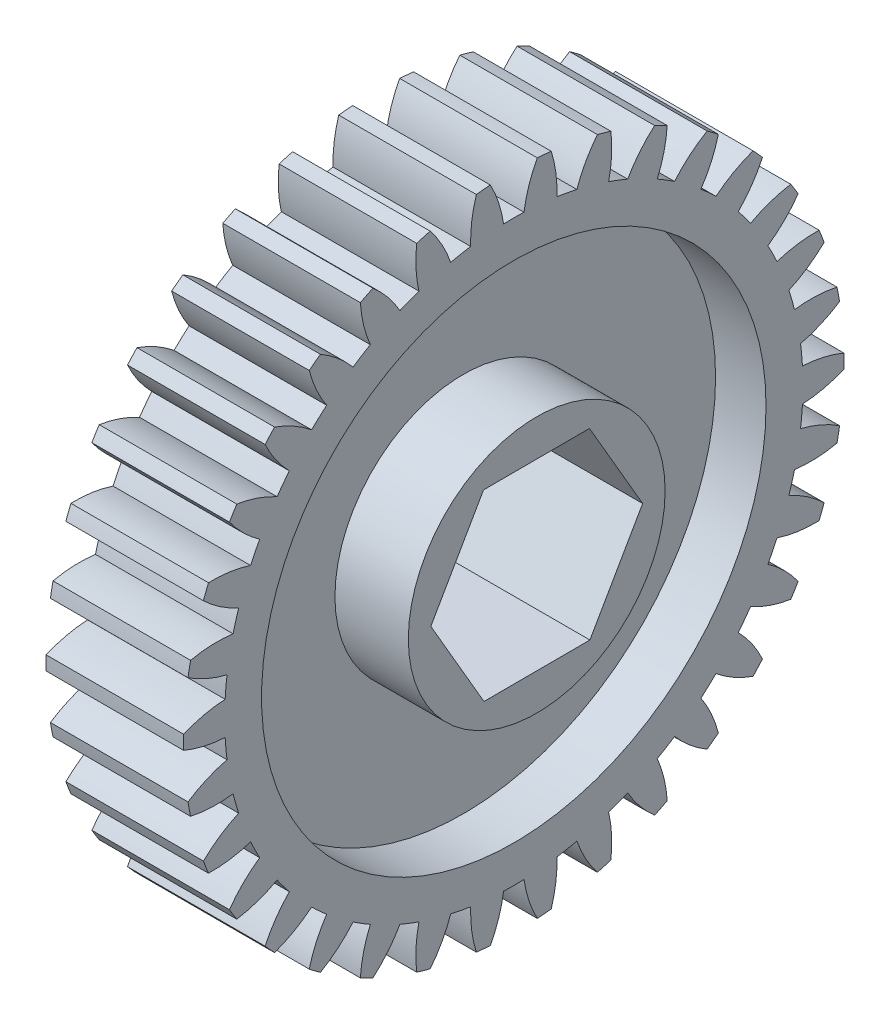
from build123d import *

# Parameters (mm, degrees)
SKETCH1_W           = 9.525
SKETCH1_H           = 22.86
CUT_EXTRUDE1_DEPTH  = 34.702890455
CUT_EXTRUDE2_DEPTH  = 34.702890455
CUT_EXTRUDE3_DEPTH  = 34.702890455
CUT_EXTRUDE4_DEPTH  = 34.702890455
CUT_EXTRUDE5_DEPTH  = 34.702890455
CUT_EXTRUDE6_DEPTH  = 34.702890455
CUT_EXTRUDE7_DEPTH  = 34.702890455
CUT_EXTRUDE8_DEPTH  = 34.702890455
CUT_EXTRUDE9_DEPTH  = 34.702890455
CUT_EXTRUDE10_DEPTH = 34.702890455
CUT_EXTRUDE11_DEPTH = 34.702890455
CUT_EXTRUDE12_DEPTH = 34.702890455
CUT_EXTRUDE13_DEPTH = 34.702890455
CUT_EXTRUDE14_DEPTH = 34.702890455
CUT_EXTRUDE15_DEPTH = 34.702890455
CUT_EXTRUDE16_DEPTH = 34.702890455
CUT_EXTRUDE17_DEPTH = 34.702890455
CUT_EXTRUDE18_DEPTH = 34.702890455
CUT_EXTRUDE19_DEPTH = 34.702890455
CUT_EXTRUDE20_DEPTH = 34.663653627
CUT_EXTRUDE21_DEPTH = 34.663653627
CUT_EXTRUDE22_DEPTH = 34.663653627
CUT_EXTRUDE23_DEPTH = 34.663653627
CUT_EXTRUDE24_DEPTH = 34.663653627
CUT_EXTRUDE25_DEPTH = 34.663653627
CUT_EXTRUDE26_DEPTH = 34.663653627
CUT_EXTRUDE27_DEPTH = 34.663653627
CUT_EXTRUDE28_DEPTH = 34.663653627
CUT_EXTRUDE29_DEPTH = 34.663653627
CUT_EXTRUDE30_DEPTH = 34.663653627
CUT_EXTRUDE31_DEPTH = 34.663653627
CUT_EXTRUDE32_DEPTH = 34.663653627
CUT_EXTRUDE33_DEPTH = 34.663653627
CUT_EXTRUDE34_DEPTH = 34.663653627
HOLE1_D             = 34.925
HOLE1_DEPTH         = 3.4925
SKETCH38_R          = 8.89
BOSS_EXTRUDE1_DEPTH = 5.08
HOLE2_D             = 34.925
HOLE2_DEPTH         = 3.4925
BOSS_EXTRUDE2_START = 5.08
SKETCH41_R          = 8.89
BOSS_EXTRUDE2_DEPTH = 5.08
CUT_EXTRUDE35_DEPTH = 35.695906826


with BuildPart() as part:
    # Sketch1 → Revolve1 (revolve)
    with BuildSketch(Plane(origin=(0, 0, 0), x_dir=(-1, 0, 0), z_dir=(0, 0, -1)), mode=Mode.PRIVATE) as revolve1_sk:
        with Locations((-4.7625, 11.43)):
            Rectangle(SKETCH1_W, SKETCH1_H)
    revolve(revolve1_sk.sketch.rotate(Axis((9.525, 0, 0), (-1, 0, 0)), 270), axis=Axis((9.525, 0, 0), (-1, 0, 0)))

    # Sketch2 → Cut-Extrude1 (cut, through all)
    with BuildSketch(Plane.ZY):
        with BuildLine():
            ThreePointArc((-2.59175236, 22.712604864), (-4.200513977, 22.470765059), (-5.788002123, 22.115122234))
            ThreePointArc((-5.788002123, 22.115122234), (-4.967471803, 20.884821102), (-4.368873641, 19.532567014))
            ThreePointArc((-4.368873641, 19.532567014), (-3.677783349, 19.674403185), (-2.982123709, 19.791795503))
            ThreePointArc((-2.982123709, 19.791795503), (-2.912438066, 21.268973485), (-2.59175236, 22.712604864))
        make_face()
    extrude(amount=-CUT_EXTRUDE1_DEPTH, mode=Mode.SUBTRACT)

    # Sketch3 → Cut-Extrude2 (cut, through all)
    with BuildSketch(Plane.ZY):
        with BuildLine():
            ThreePointArc((1.625807341, 22.802112851), (0, 22.86), (-1.625807341, 22.802112851))
            ThreePointArc((-1.625807341, 22.802112851), (-1.045315349, 21.441987884), (-0.705385495, 20.002766367))
            ThreePointArc((-0.705385495, 20.002766367), (0, 20.0152), (0.705385495, 20.002766367))
            ThreePointArc((0.705385495, 20.002766367), (1.045315349, 21.441987884), (1.625807341, 22.802112851))
        make_face()
    extrude(amount=-CUT_EXTRUDE2_DEPTH, mode=Mode.SUBTRACT)

    # Sketch4 → Cut-Extrude3 (cut, through all)
    with BuildSketch(Plane.ZY):
        with BuildLine():
            ThreePointArc((5.788002123, 22.115122234), (4.200513977, 22.470765059), (2.59175236, 22.712604864))
            ThreePointArc((2.59175236, 22.712604864), (2.912438066, 21.268973485), (2.982123709, 19.791795503))
            ThreePointArc((2.982123709, 19.791795503), (3.677783349, 19.674403185), (4.368873641, 19.532567014))
            ThreePointArc((4.368873641, 19.532567014), (4.967471803, 20.884821102), (5.788002123, 22.115122234))
        make_face()
    extrude(amount=-CUT_EXTRUDE3_DEPTH, mode=Mode.SUBTRACT)

    # Sketch5 → Cut-Extrude4 (cut, through all)
    with BuildSketch(Plane.ZY):
        with BuildLine():
            ThreePointArc((9.753093435, 20.675027653), (8.257984489, 21.316315164), (6.721053043, 21.849646359))
            ThreePointArc((6.721053043, 21.849646359), (6.771011896, 20.371669703), (6.568080266, 18.90683878))
            ThreePointArc((6.568080266, 18.90683878), (7.230324197, 18.663618166), (7.883585036, 18.397209517))
            ThreePointArc((7.883585036, 18.397209517), (8.720466963, 19.616446787), (9.753093435, 20.675027653))
        make_face()
    extrude(amount=-CUT_EXTRUDE4_DEPTH, mode=Mode.SUBTRACT)

    # Sketch6 → Cut-Extrude5 (cut, through all)
    with BuildSketch(Plane.ZY):
        with BuildLine():
            ThreePointArc((13.386054847, 18.530869802), (12.034239243, 19.435963723), (10.621476326, 20.242624352))
            ThreePointArc((10.621476326, 20.242624352), (10.399007036, 18.780633143), (9.930368727, 17.378032339))
            ThreePointArc((9.930368727, 17.378032339), (10.536645026, 17.017266015), (11.129830397, 16.635357116))
            ThreePointArc((11.129830397, 16.635357116), (12.17649708, 17.680057903), (13.386054847, 18.530869802))
        make_face()
    extrude(amount=-CUT_EXTRUDE5_DEPTH, mode=Mode.SUBTRACT)

    # Sketch7 → Cut-Extrude6 (cut, through all)
    with BuildSketch(Plane.ZY):
        with BuildLine():
            ThreePointArc((16.563170217, 15.755665406), (15.400682414, 16.893743848), (14.160197971, 17.946264052))
            ThreePointArc((14.160197971, 17.946264052), (13.672876465, 16.550044646), (12.954490392, 15.257437849))
            ThreePointArc((12.954490392, 15.257437849), (13.484153047, 14.79141128), (13.997062733, 14.30700758))
            ThreePointArc((13.997062733, 14.30700758), (15.217871193, 15.141595853), (16.563170217, 15.755665406))
        make_face()
    extrude(amount=-CUT_EXTRUDE6_DEPTH, mode=Mode.SUBTRACT)

    # Sketch8 → Cut-Extrude7 (cut, through all)
    with BuildSketch(Plane.ZY):
        with BuildLine():
            ThreePointArc((19.17624669, 12.44392072), (18.242673816, 13.776227788), (17.216711058, 15.038765253))
            ThreePointArc((17.216711058, 15.038765253), (16.481132483, 13.755864228), (15.537462423, 12.617269613))
            ThreePointArc((15.537462423, 12.617269613), (15.972474407, 12.061852774), (16.387641885, 11.49145006))
            ThreePointArc((16.387641885, 11.49145006), (17.741018954, 12.087504915), (19.17624669, 12.44392072))
        make_face()
    extrude(amount=-CUT_EXTRUDE7_DEPTH, mode=Mode.SUBTRACT)

    # Sketch9 → Cut-Extrude8 (cut, through all)
    with BuildSketch(Plane.ZY):
        with BuildLine():
            ThreePointArc((21.136299081, 8.70841324), (20.46343284, 10.189578813), (19.686929699, 11.619139341))
            ThreePointArc((19.686929699, 11.619139341), (18.728143303, 10.493244352), (17.591324807, 9.547435393))
            ThreePointArc((17.591324807, 9.547435393), (17.916872309, 8.921542339), (18.220159548, 8.284564991))
            ThreePointArc((18.220159548, 8.284564991), (19.660017592, 8.621788496), (21.136299081, 8.70841324))
        make_face()
    extrude(amount=-CUT_EXTRUDE8_DEPTH, mode=Mode.SUBTRACT)

    # Sketch10 → Cut-Extrude9 (cut, through all)
    with BuildSketch(Plane.ZY):
        with BuildLine():
            ThreePointArc((22.376580157, 4.676351191), (21.987334203, 6.255935953), (21.486733561, 7.803837574))
            ThreePointArc((21.486733561, 7.803837574), (20.337389664, 6.873289625), (19.046135723, 6.152474711))
            ThreePointArc((19.046135723, 6.152474711), (19.251132613, 5.477419479), (19.43221153, 4.795558997))
            ThreePointArc((19.43221153, 4.795558997), (20.909517911, 4.86246741), (22.376580157, 4.676351191))
        make_face()
    extrude(amount=-CUT_EXTRUDE9_DEPTH, mode=Mode.SUBTRACT)

    # Sketch11 → Cut-Extrude10 (cut, through all)
    with BuildSketch(Plane.ZY):
        with BuildLine():
            ThreePointArc((22.854853634, 0.485041611), (22.76248327, 2.109254697), (22.554832482, 3.722785479))
            ThreePointArc((22.554832482, 3.722785479), (21.254070611, 3.019273263), (19.85235333, 2.547998882))
            ThreePointArc((19.85235333, 2.547998882), (19.929818685, 1.846769668), (19.982522855, 1.143245993))
            ThreePointArc((19.982522855, 1.143245993), (21.446969676, 0.937560828), (22.854853634, 0.485041611))
        make_face()
    extrude(amount=-CUT_EXTRUDE10_DEPTH, mode=Mode.SUBTRACT)

    # Sketch12 → Cut-Extrude11 (cut, through all)
    with BuildSketch(Plane.ZY):
        with BuildLine():
            ThreePointArc((22.554832482, -3.722785479), (22.76248327, -2.109254697), (22.854853634, -0.485041611))
            ThreePointArc((22.854853634, -0.485041611), (21.446969676, -0.937560828), (19.982522855, -1.143245993))
            ThreePointArc((19.982522855, -1.143245993), (19.929818685, -1.846769668), (19.85235333, -2.547998882))
            ThreePointArc((19.85235333, -2.547998882), (21.254070611, -3.019273263), (22.554832482, -3.722785479))
        make_face()
    extrude(amount=-CUT_EXTRUDE11_DEPTH, mode=Mode.SUBTRACT)

    # Sketch13 → Cut-Extrude12 (cut, through all)
    with BuildSketch(Plane.ZY):
        with BuildLine():
            ThreePointArc((21.486733561, -7.803837574), (21.987334203, -6.255935953), (22.376580157, -4.676351191))
            ThreePointArc((22.376580157, -4.676351191), (20.909517911, -4.86246741), (19.43221153, -4.795558997))
            ThreePointArc((19.43221153, -4.795558997), (19.251132613, -5.477419479), (19.046135723, -6.152474711))
            ThreePointArc((19.046135723, -6.152474711), (20.337389664, -6.873289625), (21.486733561, -7.803837574))
        make_face()
    extrude(amount=-CUT_EXTRUDE12_DEPTH, mode=Mode.SUBTRACT)

    # Sketch14 → Cut-Extrude13 (cut, through all)
    with BuildSketch(Plane.ZY):
        with BuildLine():
            ThreePointArc((19.686929699, -11.619139341), (20.46343284, -10.189578813), (21.136299081, -8.70841324))
            ThreePointArc((21.136299081, -8.70841324), (19.660017592, -8.621788496), (18.220159548, -8.284564991))
            ThreePointArc((18.220159548, -8.284564991), (17.916872309, -8.921542339), (17.591324807, -9.547435393))
            ThreePointArc((17.591324807, -9.547435393), (18.728143303, -10.493244352), (19.686929699, -11.619139341))
        make_face()
    extrude(amount=-CUT_EXTRUDE13_DEPTH, mode=Mode.SUBTRACT)

    # Sketch15 → Cut-Extrude14 (cut, through all)
    with BuildSketch(Plane.ZY):
        with BuildLine():
            ThreePointArc((17.216711058, -15.038765253), (18.242673816, -13.776227788), (19.17624669, -12.44392072))
            ThreePointArc((19.17624669, -12.44392072), (17.741018954, -12.087504915), (16.387641885, -11.49145006))
            ThreePointArc((16.387641885, -11.49145006), (15.972474407, -12.061852774), (15.537462423, -12.617269613))
            ThreePointArc((15.537462423, -12.617269613), (16.481132483, -13.755864228), (17.216711058, -15.038765253))
        make_face()
    extrude(amount=-CUT_EXTRUDE14_DEPTH, mode=Mode.SUBTRACT)

    # Sketch16 → Cut-Extrude15 (cut, through all)
    with BuildSketch(Plane.ZY):
        with BuildLine():
            ThreePointArc((14.160197971, -17.946264052), (15.400682414, -16.893743848), (16.563170217, -15.755665406))
            ThreePointArc((16.563170217, -15.755665406), (15.217871193, -15.141595853), (13.997062733, -14.30700758))
            ThreePointArc((13.997062733, -14.30700758), (13.484153047, -14.79141128), (12.954490392, -15.257437849))
            ThreePointArc((12.954490392, -15.257437849), (13.672876465, -16.550044646), (14.160197971, -17.946264052))
        make_face()
    extrude(amount=-CUT_EXTRUDE15_DEPTH, mode=Mode.SUBTRACT)

    # Sketch17 → Cut-Extrude16 (cut, through all)
    with BuildSketch(Plane.ZY):
        with BuildLine():
            ThreePointArc((10.621476326, -20.242624352), (12.034239243, -19.435963723), (13.386054847, -18.530869802))
            ThreePointArc((13.386054847, -18.530869802), (12.17649708, -17.680057903), (11.129830397, -16.635357116))
            ThreePointArc((11.129830397, -16.635357116), (10.536645026, -17.017266015), (9.930368727, -17.378032339))
            ThreePointArc((9.930368727, -17.378032339), (10.399007036, -18.780633143), (10.621476326, -20.242624352))
        make_face()
    extrude(amount=-CUT_EXTRUDE16_DEPTH, mode=Mode.SUBTRACT)

    # Sketch18 → Cut-Extrude17 (cut, through all)
    with BuildSketch(Plane.ZY):
        with BuildLine():
            ThreePointArc((6.721053043, -21.849646359), (8.257984489, -21.316315164), (9.753093435, -20.675027653))
            ThreePointArc((9.753093435, -20.675027653), (8.720466963, -19.616446787), (7.883585036, -18.397209517))
            ThreePointArc((7.883585036, -18.397209517), (7.230324197, -18.663618166), (6.568080266, -18.90683878))
            ThreePointArc((6.568080266, -18.90683878), (6.771011896, -20.371669703), (6.721053043, -21.849646359))
        make_face()
    extrude(amount=-CUT_EXTRUDE17_DEPTH, mode=Mode.SUBTRACT)

    # Sketch19 → Cut-Extrude18 (cut, through all)
    with BuildSketch(Plane.ZY):
        with BuildLine():
            ThreePointArc((2.59175236, -22.712604864), (4.200513977, -22.470765059), (5.788002123, -22.115122234))
            ThreePointArc((5.788002123, -22.115122234), (4.967471803, -20.884821102), (4.368873641, -19.532567014))
            ThreePointArc((4.368873641, -19.532567014), (3.677783349, -19.674403185), (2.982123709, -19.791795503))
            ThreePointArc((2.982123709, -19.791795503), (2.912438066, -21.268973485), (2.59175236, -22.712604864))
        make_face()
    extrude(amount=-CUT_EXTRUDE18_DEPTH, mode=Mode.SUBTRACT)

    # Sketch20 → Cut-Extrude19 (cut, through all)
    with BuildSketch(Plane.ZY):
        with BuildLine():
            ThreePointArc((-1.625807341, -22.802112851), (0, -22.86), (1.625807341, -22.802112851))
            ThreePointArc((1.625807341, -22.802112851), (1.045315349, -21.441987884), (0.705385495, -20.002766367))
            ThreePointArc((0.705385495, -20.002766367), (0, -20.0152), (-0.705385495, -20.002766367))
            ThreePointArc((-0.705385495, -20.002766367), (-1.045315349, -21.441987884), (-1.625807341, -22.802112851))
        make_face()
    extrude(amount=-CUT_EXTRUDE19_DEPTH, mode=Mode.SUBTRACT)

    # Sketch21 → Cut-Extrude20 (cut, through all)
    with BuildSketch(Plane.ZY):
        with BuildLine():
            ThreePointArc((-5.788002123, -22.115122234), (-4.200513977, -22.470765059), (-2.59175236, -22.712604864))
            ThreePointArc((-2.59175236, -22.712604864), (-2.912438066, -21.268973485), (-2.982123709, -19.791795503))
            ThreePointArc((-2.982123709, -19.791795503), (-3.677783349, -19.674403185), (-4.368873641, -19.532567014))
            ThreePointArc((-4.368873641, -19.532567014), (-4.967471803, -20.884821102), (-5.788002123, -22.115122234))
        make_face()
    extrude(amount=-CUT_EXTRUDE20_DEPTH, mode=Mode.SUBTRACT)

    # Sketch22 → Cut-Extrude21 (cut, through all)
    with BuildSketch(Plane.ZY):
        with BuildLine():
            ThreePointArc((-9.753093435, -20.675027653), (-8.257984489, -21.316315164), (-6.721053043, -21.849646359))
            ThreePointArc((-6.721053043, -21.849646359), (-6.771011896, -20.371669703), (-6.568080266, -18.90683878))
            ThreePointArc((-6.568080266, -18.90683878), (-7.230324197, -18.663618166), (-7.883585036, -18.397209517))
            ThreePointArc((-7.883585036, -18.397209517), (-8.720466963, -19.616446787), (-9.753093435, -20.675027653))
        make_face()
    extrude(amount=-CUT_EXTRUDE21_DEPTH, mode=Mode.SUBTRACT)

    # Sketch23 → Cut-Extrude22 (cut, through all)
    with BuildSketch(Plane.ZY):
        with BuildLine():
            ThreePointArc((-13.386054847, -18.530869802), (-12.034239243, -19.435963723), (-10.621476326, -20.242624352))
            ThreePointArc((-10.621476326, -20.242624352), (-10.399007036, -18.780633143), (-9.930368727, -17.378032339))
            ThreePointArc((-9.930368727, -17.378032339), (-10.536645026, -17.017266015), (-11.129830397, -16.635357116))
            ThreePointArc((-11.129830397, -16.635357116), (-12.17649708, -17.680057903), (-13.386054847, -18.530869802))
        make_face()
    extrude(amount=-CUT_EXTRUDE22_DEPTH, mode=Mode.SUBTRACT)

    # Sketch24 → Cut-Extrude23 (cut, through all)
    with BuildSketch(Plane.ZY):
        with BuildLine():
            ThreePointArc((-16.563170217, -15.755665406), (-15.400682414, -16.893743848), (-14.160197971, -17.946264052))
            ThreePointArc((-14.160197971, -17.946264052), (-13.672876465, -16.550044646), (-12.954490392, -15.257437849))
            ThreePointArc((-12.954490392, -15.257437849), (-13.484153047, -14.79141128), (-13.997062733, -14.30700758))
            ThreePointArc((-13.997062733, -14.30700758), (-15.217871193, -15.141595853), (-16.563170217, -15.755665406))
        make_face()
    extrude(amount=-CUT_EXTRUDE23_DEPTH, mode=Mode.SUBTRACT)

    # Sketch25 → Cut-Extrude24 (cut, through all)
    with BuildSketch(Plane.ZY):
        with BuildLine():
            ThreePointArc((-19.17624669, -12.44392072), (-18.242673816, -13.776227788), (-17.216711058, -15.038765253))
            ThreePointArc((-17.216711058, -15.038765253), (-16.481132483, -13.755864228), (-15.537462423, -12.617269613))
            ThreePointArc((-15.537462423, -12.617269613), (-15.972474407, -12.061852774), (-16.387641885, -11.49145006))
            ThreePointArc((-16.387641885, -11.49145006), (-17.741018954, -12.087504915), (-19.17624669, -12.44392072))
        make_face()
    extrude(amount=-CUT_EXTRUDE24_DEPTH, mode=Mode.SUBTRACT)

    # Sketch26 → Cut-Extrude25 (cut, through all)
    with BuildSketch(Plane.ZY):
        with BuildLine():
            ThreePointArc((-21.136299081, -8.70841324), (-20.46343284, -10.189578813), (-19.686929699, -11.619139341))
            ThreePointArc((-19.686929699, -11.619139341), (-18.728143303, -10.493244352), (-17.591324807, -9.547435393))
            ThreePointArc((-17.591324807, -9.547435393), (-17.916872309, -8.921542339), (-18.220159548, -8.284564991))
            ThreePointArc((-18.220159548, -8.284564991), (-19.660017592, -8.621788496), (-21.136299081, -8.70841324))
        make_face()
    extrude(amount=-CUT_EXTRUDE25_DEPTH, mode=Mode.SUBTRACT)

    # Sketch27 → Cut-Extrude26 (cut, through all)
    with BuildSketch(Plane.ZY):
        with BuildLine():
            ThreePointArc((-22.376580157, -4.676351191), (-21.987334203, -6.255935953), (-21.486733561, -7.803837574))
            ThreePointArc((-21.486733561, -7.803837574), (-20.337389664, -6.873289625), (-19.046135723, -6.152474711))
            ThreePointArc((-19.046135723, -6.152474711), (-19.251132613, -5.477419479), (-19.43221153, -4.795558997))
            ThreePointArc((-19.43221153, -4.795558997), (-20.909517911, -4.86246741), (-22.376580157, -4.676351191))
        make_face()
    extrude(amount=-CUT_EXTRUDE26_DEPTH, mode=Mode.SUBTRACT)

    # Sketch28 → Cut-Extrude27 (cut, through all)
    with BuildSketch(Plane.ZY):
        with BuildLine():
            ThreePointArc((-22.854853634, -0.485041611), (-22.76248327, -2.109254697), (-22.554832482, -3.722785479))
            ThreePointArc((-22.554832482, -3.722785479), (-21.254070611, -3.019273263), (-19.85235333, -2.547998882))
            ThreePointArc((-19.85235333, -2.547998882), (-19.929818685, -1.846769668), (-19.982522855, -1.143245993))
            ThreePointArc((-19.982522855, -1.143245993), (-21.446969676, -0.937560828), (-22.854853634, -0.485041611))
        make_face()
    extrude(amount=-CUT_EXTRUDE27_DEPTH, mode=Mode.SUBTRACT)

    # Sketch29 → Cut-Extrude28 (cut, through all)
    with BuildSketch(Plane.ZY):
        with BuildLine():
            ThreePointArc((-22.554832482, 3.722785479), (-22.76248327, 2.109254697), (-22.854853634, 0.485041611))
            ThreePointArc((-22.854853634, 0.485041611), (-21.446969676, 0.937560828), (-19.982522855, 1.143245993))
            ThreePointArc((-19.982522855, 1.143245993), (-19.929818685, 1.846769668), (-19.85235333, 2.547998882))
            ThreePointArc((-19.85235333, 2.547998882), (-21.254070611, 3.019273263), (-22.554832482, 3.722785479))
        make_face()
    extrude(amount=-CUT_EXTRUDE28_DEPTH, mode=Mode.SUBTRACT)

    # Sketch30 → Cut-Extrude29 (cut, through all)
    with BuildSketch(Plane.ZY):
        with BuildLine():
            ThreePointArc((-21.486733561, 7.803837574), (-21.987334203, 6.255935953), (-22.376580157, 4.676351191))
            ThreePointArc((-22.376580157, 4.676351191), (-20.909517911, 4.86246741), (-19.43221153, 4.795558997))
            ThreePointArc((-19.43221153, 4.795558997), (-19.251132613, 5.477419479), (-19.046135723, 6.152474711))
            ThreePointArc((-19.046135723, 6.152474711), (-20.337389664, 6.873289625), (-21.486733561, 7.803837574))
        make_face()
    extrude(amount=-CUT_EXTRUDE29_DEPTH, mode=Mode.SUBTRACT)

    # Sketch31 → Cut-Extrude30 (cut, through all)
    with BuildSketch(Plane.ZY):
        with BuildLine():
            ThreePointArc((-19.686929699, 11.619139341), (-20.46343284, 10.189578813), (-21.136299081, 8.70841324))
            ThreePointArc((-21.136299081, 8.70841324), (-19.660017592, 8.621788496), (-18.220159548, 8.284564991))
            ThreePointArc((-18.220159548, 8.284564991), (-17.916872309, 8.921542339), (-17.591324807, 9.547435393))
            ThreePointArc((-17.591324807, 9.547435393), (-18.728143303, 10.493244352), (-19.686929699, 11.619139341))
        make_face()
    extrude(amount=-CUT_EXTRUDE30_DEPTH, mode=Mode.SUBTRACT)

    # Sketch32 → Cut-Extrude31 (cut, through all)
    with BuildSketch(Plane.ZY):
        with BuildLine():
            ThreePointArc((-17.216711058, 15.038765253), (-18.242673816, 13.776227788), (-19.17624669, 12.44392072))
            ThreePointArc((-19.17624669, 12.44392072), (-17.741018954, 12.087504915), (-16.387641885, 11.49145006))
            ThreePointArc((-16.387641885, 11.49145006), (-15.972474407, 12.061852774), (-15.537462423, 12.617269613))
            ThreePointArc((-15.537462423, 12.617269613), (-16.481132483, 13.755864228), (-17.216711058, 15.038765253))
        make_face()
    extrude(amount=-CUT_EXTRUDE31_DEPTH, mode=Mode.SUBTRACT)

    # Sketch33 → Cut-Extrude32 (cut, through all)
    with BuildSketch(Plane.ZY):
        with BuildLine():
            ThreePointArc((-14.160197971, 17.946264052), (-15.400682414, 16.893743848), (-16.563170217, 15.755665406))
            ThreePointArc((-16.563170217, 15.755665406), (-15.217871193, 15.141595853), (-13.997062733, 14.30700758))
            ThreePointArc((-13.997062733, 14.30700758), (-13.484153047, 14.79141128), (-12.954490392, 15.257437849))
            ThreePointArc((-12.954490392, 15.257437849), (-13.672876465, 16.550044646), (-14.160197971, 17.946264052))
        make_face()
    extrude(amount=-CUT_EXTRUDE32_DEPTH, mode=Mode.SUBTRACT)

    # Sketch34 → Cut-Extrude33 (cut, through all)
    with BuildSketch(Plane.ZY):
        with BuildLine():
            ThreePointArc((-10.621476326, 20.242624352), (-12.034239243, 19.435963723), (-13.386054847, 18.530869802))
            ThreePointArc((-13.386054847, 18.530869802), (-12.17649708, 17.680057903), (-11.129830397, 16.635357116))
            ThreePointArc((-11.129830397, 16.635357116), (-10.536645026, 17.017266015), (-9.930368727, 17.378032339))
            ThreePointArc((-9.930368727, 17.378032339), (-10.399007036, 18.780633143), (-10.621476326, 20.242624352))
        make_face()
    extrude(amount=-CUT_EXTRUDE33_DEPTH, mode=Mode.SUBTRACT)

    # Sketch35 → Cut-Extrude34 (cut, through all)
    with BuildSketch(Plane.ZY):
        with BuildLine():
            ThreePointArc((-6.721053043, 21.849646359), (-8.257984489, 21.316315164), (-9.753093435, 20.675027653))
            ThreePointArc((-9.753093435, 20.675027653), (-8.720466963, 19.616446787), (-7.883585036, 18.397209517))
            ThreePointArc((-7.883585036, 18.397209517), (-7.230324197, 18.663618166), (-6.568080266, 18.90683878))
            ThreePointArc((-6.568080266, 18.90683878), (-6.771011896, 20.371669703), (-6.721053043, 21.849646359))
        make_face()
    extrude(amount=-CUT_EXTRUDE34_DEPTH, mode=Mode.SUBTRACT)

    # Hole1
    with Locations(Plane(origin=(9.525, 0, 0), x_dir=(0, 0, -1), z_dir=(1, 0, 0))):
        with Locations((0, 0)):
            Hole(HOLE1_D / 2, depth=HOLE1_DEPTH)

    # Sketch38 → Boss-Extrude1 (add)
    with BuildSketch(Plane(origin=(6.0325, 0, 0), x_dir=(0, 0, -1), z_dir=(1, 0, 0))):
        with Locations(Location((0, 0, 0), (0, 0, 180))):
            Circle(SKETCH38_R)
    extrude(amount=BOSS_EXTRUDE1_DEPTH)

    # Hole2
    with Locations(Plane.ZY):
        with Locations((0, 0)):
            Hole(HOLE2_D / 2, depth=HOLE2_DEPTH)

    # Sketch41 → Boss-Extrude2 (add)
    with BuildSketch(Plane.ZY.offset(-3.4925).offset(BOSS_EXTRUDE2_START)):
        Circle(SKETCH41_R)
    extrude(amount=-BOSS_EXTRUDE2_DEPTH)

    # Sketch42 → Cut-Extrude35 (cut, through all)
    with BuildSketch(Plane.ZY.offset(1.5875)):
        Polygon((-3.650042984, 6.359286088), (-7.332324794, 0.018613095), (-3.68228181, -6.340672993), (3.650042984, -6.359286088), (7.332324794, -0.018613095), (3.68228181, 6.340672993), align=None)
    extrude(amount=-CUT_EXTRUDE35_DEPTH, mode=Mode.SUBTRACT)


solid = part.part
